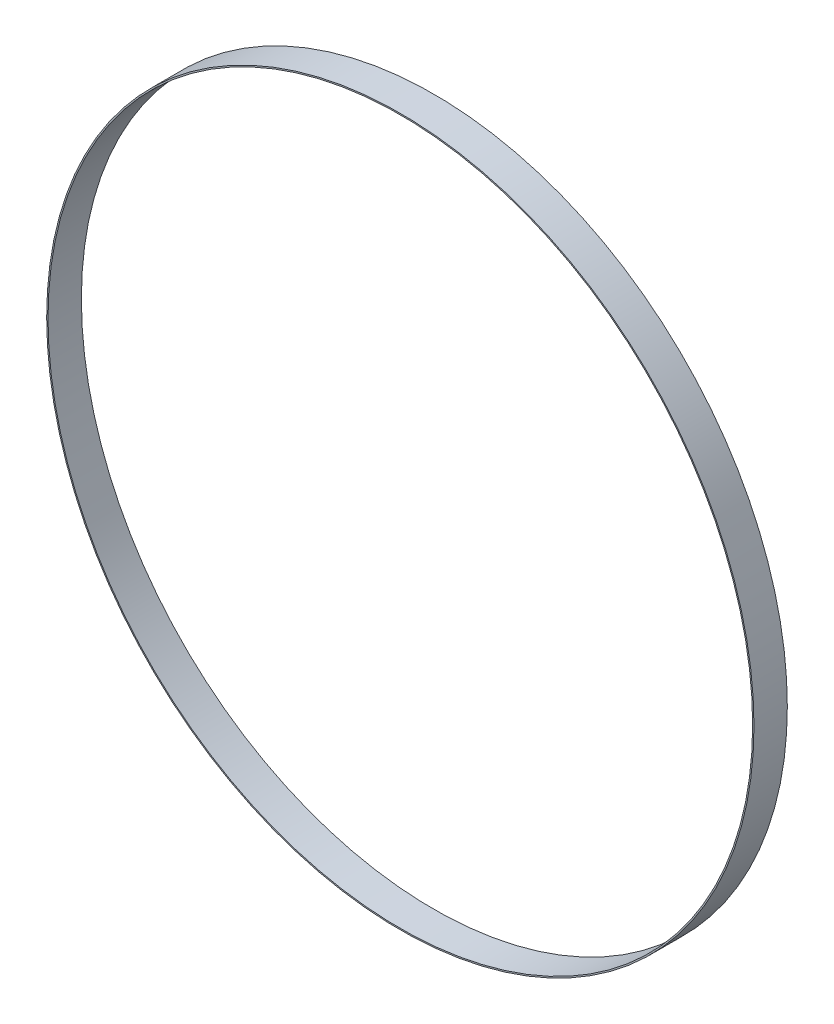
from build123d import *

# Parameters (mm, degrees)
SKETCH1_R           = 1060
SKETCH1_R_2         = 1056
BOSS_EXTRUDE1_DEPTH = 100


with BuildPart() as part:
    # Sketch1 → Boss-Extrude1 (new body)
    with BuildSketch(Plane.XY):
        Circle(SKETCH1_R)
        Circle(SKETCH1_R_2, mode=Mode.SUBTRACT)
    extrude(amount=BOSS_EXTRUDE1_DEPTH)


solid = part.part
